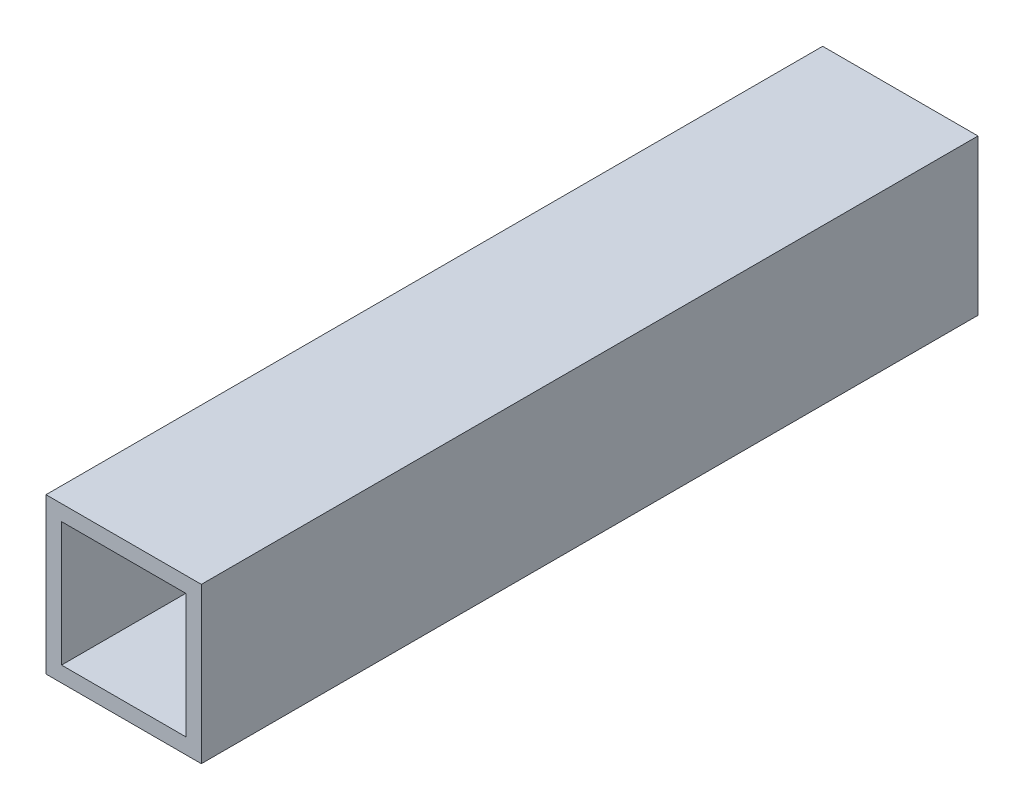
from build123d import *

# Parameters (mm, degrees)
BOSS_EXTRUDE1_DEPTH      = 175
BOSS_EXTRUDE1_DEPTH_BACK = 75
SKETCH1_W                = 50
SKETCH1_H                = 50
SKETCH1_W_2              = 40
SKETCH1_H_2              = 40


with BuildPart() as part:
    # Sketch1 → Boss-Extrude1 (new, two sides: drawn at the far end of the back side and taken through both)
    with BuildSketch(Plane.XY.offset(-BOSS_EXTRUDE1_DEPTH_BACK)):
        Rectangle(SKETCH1_W, SKETCH1_H)
        Rectangle(SKETCH1_W_2, SKETCH1_H_2, mode=Mode.SUBTRACT)
    extrude(amount=BOSS_EXTRUDE1_DEPTH + BOSS_EXTRUDE1_DEPTH_BACK)


solid = part.part
